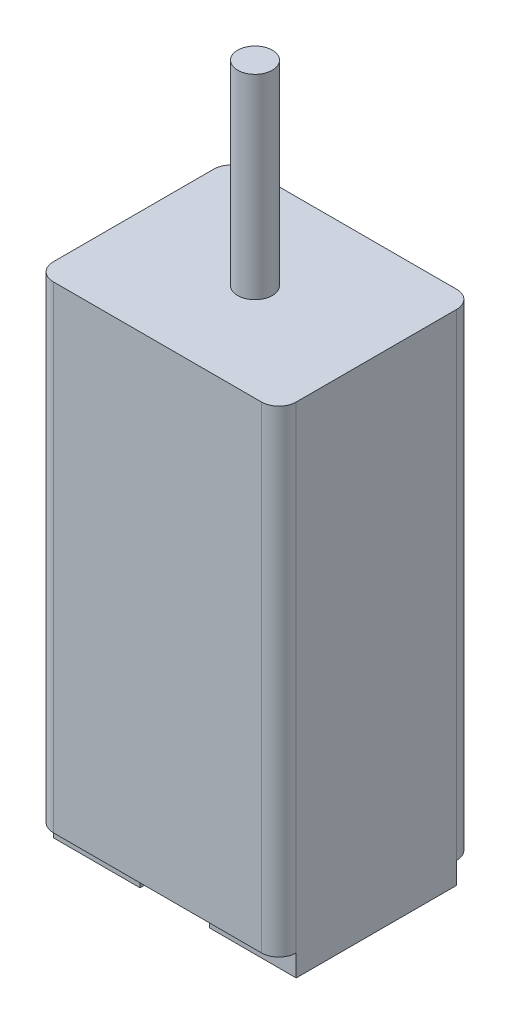
from build123d import *

# Parameters (mm, degrees)
SKETCH1_W           = 5.6
SKETCH1_H           = 4.5
BOSS_EXTRUDE1_DEPTH = 11
SKETCH2_R           = 0.4
BOSS_EXTRUDE2_DEPTH = 4.5
FILLET1_R           = 0.4
BOSS_EXTRUDE3_DEPTH = 0.5


with BuildPart() as part:
    # Sketch1 → Boss-Extrude1 (new body)
    with BuildSketch(Plane(origin=(0, 0, 0), x_dir=(1, 0, 0), z_dir=(0, 1, 0))):
        Rectangle(SKETCH1_W, SKETCH1_H)
    extrude(amount=BOSS_EXTRUDE1_DEPTH)

    # Sketch2 → Boss-Extrude2 (add)
    with BuildSketch(Plane(origin=(0, 11, 0), x_dir=(1, 0, 0), z_dir=(0, 1, 0))):
        with Locations(Location((0, 0, 0), (0, 0, 270))):
            Circle(SKETCH2_R)
    extrude(amount=BOSS_EXTRUDE2_DEPTH)

    # Fillet1
    fillet1_edges = [part.edges().sort_by_distance(p)[0] for p in [
        (2.8, 5.5, 2.25),
        (-2.8, 5.5, 2.25),
        (-2.8, 5.5, -2.25),
        (2.8, 5.5, -2.25),
    ]]
    fillet(fillet1_edges, radius=FILLET1_R)

    # Sketch3 → Boss-Extrude3 (add)
    with BuildSketch(Plane.XZ):
        with BuildLine():
            Line((-2.8, 1.85), (-0.8, 1.85))
            Line((-0.8, 1.85), (-0.8, -0.691387744))
            ThreePointArc((-0.8, -0.691387744), (-0.34347642, -1.270693872), (-0.8, -1.85))
            Line((-0.8, -1.85), (-2.8, -1.85))
            Line((-2.8, -1.85), (-2.8, 1.85))
        make_face()
        with BuildLine():
            Line((2.8, -1.85), (0.8, -1.85))
            ThreePointArc((0.8, -1.85), (0.384893305, -1.270693872), (0.8, -0.691387744))
            Line((0.8, -0.691387744), (0.8, 1.85))
            Line((0.8, 1.85), (2.8, 1.85))
            Line((2.8, 1.85), (2.8, -1.85))
        make_face()
    extrude(amount=BOSS_EXTRUDE3_DEPTH)


solid = part.part
